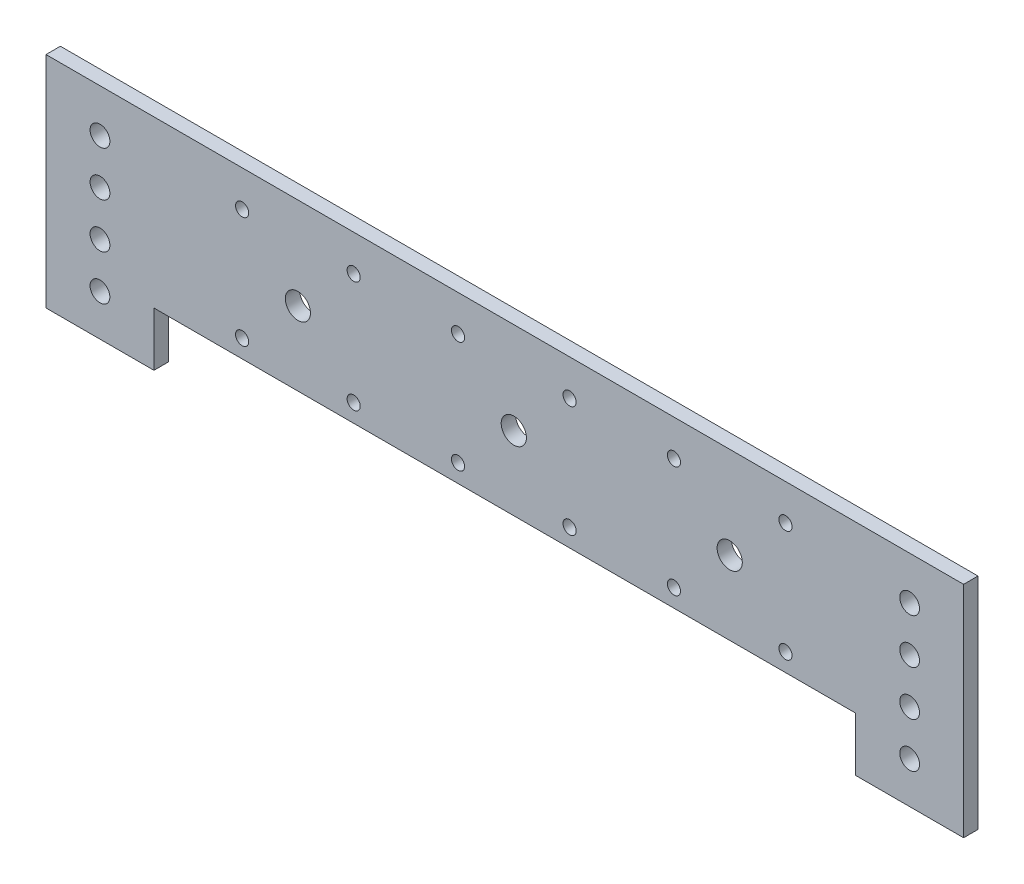
from build123d import *

# Parameters (mm, degrees)
SKETCH1_W            = 161
SKETCH1_H            = 46
SKETCH1_R            = 1.825
SKETCH1_R_2          = 3.5
BOSS_EXTRUDE1_DEPTH  = 4
SKETCH2_W            = 49.5
SKETCH2_H            = 46
SKETCH2_W_2          = 30
SKETCH2_H_2          = 15
SKETCH2_W_3          = 44.5
BOSS_EXTRUDE2_DEPTH  = 4
M5_CLEARANCE_HOLE1_D = 5.5


with BuildPart() as part:
    # Sketch1 → Boss-Extrude1 (new body)
    with BuildSketch(Plane.XY):
        Rectangle(SKETCH1_W, SKETCH1_H)
        with Locations((-75.5, 13)):
            Circle(SKETCH1_R, mode=Mode.SUBTRACT)
        with Locations((-44.5, 13)):
            Circle(SKETCH1_R, mode=Mode.SUBTRACT)
        with Locations((-75.5, -18)):
            Circle(SKETCH1_R, mode=Mode.SUBTRACT)
        with Locations((-44.5, -18)):
            Circle(SKETCH1_R, mode=Mode.SUBTRACT)
        with Locations((60, -2.5)):
            Circle(SKETCH1_R_2, mode=Mode.SUBTRACT)
        with Locations((-15.5, 13)):
            Circle(SKETCH1_R, mode=Mode.SUBTRACT)
        with Locations((15.5, 13)):
            Circle(SKETCH1_R, mode=Mode.SUBTRACT)
        with Locations((-15.5, -18)):
            Circle(SKETCH1_R, mode=Mode.SUBTRACT)
        with Locations((15.5, -18)):
            Circle(SKETCH1_R, mode=Mode.SUBTRACT)
        with Locations((44.5, -18)):
            Circle(SKETCH1_R, mode=Mode.SUBTRACT)
        with Locations((75.5, -18)):
            Circle(SKETCH1_R, mode=Mode.SUBTRACT)
        with Locations((-60, -2.5)):
            Circle(SKETCH1_R_2, mode=Mode.SUBTRACT)
        with Locations((0, -2.5)):
            Circle(SKETCH1_R_2, mode=Mode.SUBTRACT)
        with Locations((44.5, 13)):
            Circle(SKETCH1_R, mode=Mode.SUBTRACT)
        with Locations((75.5, 13)):
            Circle(SKETCH1_R, mode=Mode.SUBTRACT)
    extrude(amount=BOSS_EXTRUDE1_DEPTH)

    # Sketch2 → Boss-Extrude2 (add)
    with BuildSketch(Plane.XY.offset(4)):
        with Locations((-105.25, 0)):
            Rectangle(SKETCH2_W, SKETCH2_H)
        with Locations((-115, -30.5)):
            Rectangle(SKETCH2_W_2, SKETCH2_H_2)
        with Locations((102.75, 0)):
            Rectangle(SKETCH2_W_3, SKETCH2_H)
        with Locations((110, -30.5)):
            Rectangle(SKETCH2_W_2, SKETCH2_H_2)
    extrude(amount=-BOSS_EXTRUDE2_DEPTH)

    # M5 Clearance Hole1 (through all)
    with Locations(Plane.XY.offset(4)):
        with Locations((-115, -1.5), (-115, -26.5), (110, -1.5), (110, -26.5), (-115, 11), (110, 11), (110, -14), (-115, -14)):
            Hole(M5_CLEARANCE_HOLE1_D / 2)


solid = part.part
